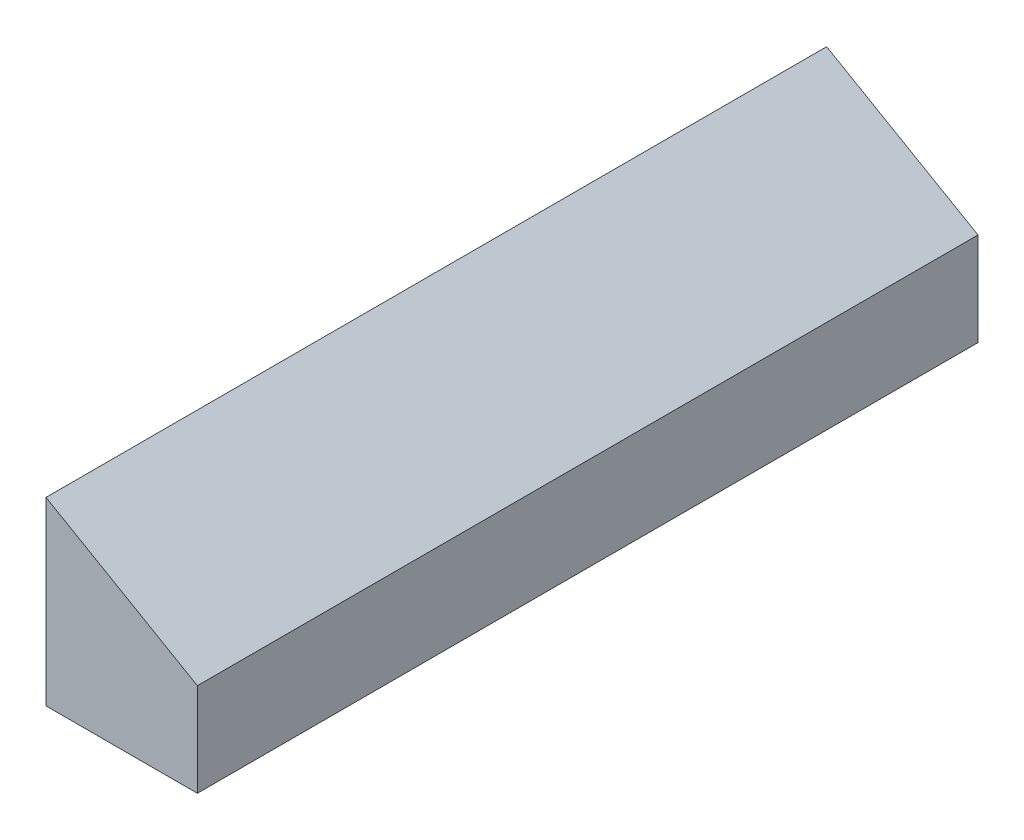
from build123d import *

# Parameters (mm, degrees)
BOSS_EXTRUDE1_DEPTH = 67


with BuildPart() as part:
    # Sketch1 → Boss-Extrude1 (new body)
    with BuildSketch(Plane.XY):
        Polygon((0, 0), (0, 15.5), (12.990381057, 8), (12.990381057, 0), align=None)
    extrude(amount=BOSS_EXTRUDE1_DEPTH)


solid = part.part
